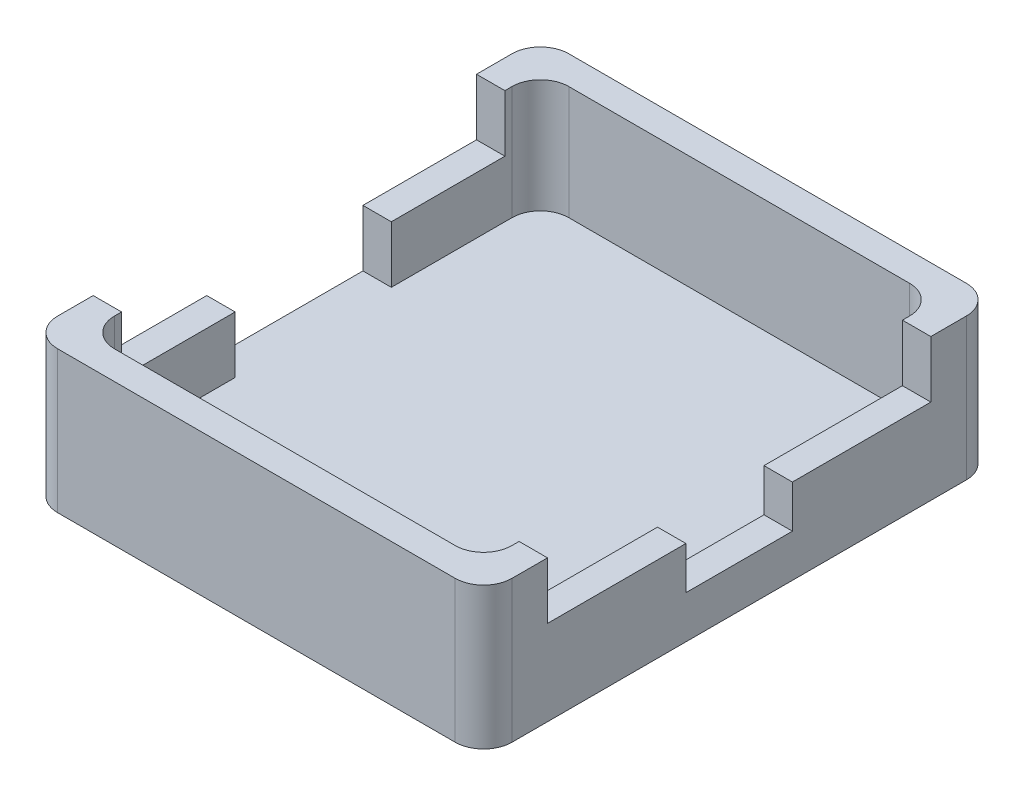
from build123d import *

# Parameters (mm, degrees)
SKETCH1_W           = 32
SKETCH1_H           = 36
BOSS_EXTRUDE1_DEPTH = 2
SKETCH2_W           = 32
SKETCH2_H           = 36
SKETCH2_W_2         = 28
SKETCH2_H_2         = 32
BOSS_EXTRUDE2_DEPTH = 8
CUT_EXTRUDE1_DEPTH  = 2
CUT_EXTRUDE2_DEPTH  = 2
FILLET1_R           = 2


with BuildPart() as part:
    # Sketch1 → Boss-Extrude1 (new body)
    with BuildSketch(Plane(origin=(0, 0, 0), x_dir=(1, 0, 0), z_dir=(0, 1, 0))):
        Rectangle(SKETCH1_W, SKETCH1_H)
    extrude(amount=BOSS_EXTRUDE1_DEPTH)

    # Sketch2 → Boss-Extrude2 (add)
    with BuildSketch(Plane(origin=(0, 2, 0), x_dir=(1, 0, 0), z_dir=(0, 1, 0))):
        Rectangle(SKETCH2_W, SKETCH2_H)
        Rectangle(SKETCH2_W_2, SKETCH2_H_2, mode=Mode.SUBTRACT)
    extrude(amount=BOSS_EXTRUDE2_DEPTH)

    # Sketch3 → Cut-Extrude1 (cut)
    with BuildSketch(Plane.ZY.offset(16)):
        Polygon((-13.5, 10), (-13.5, 6), (-5.5, 6), (-5.5, 2), (5.5, 2), (5.5, 6), (13.5, 6), (13.5, 10), align=None)
    extrude(amount=-CUT_EXTRUDE1_DEPTH, mode=Mode.SUBTRACT)

    # Sketch4 → Cut-Extrude2 (cut)
    with BuildSketch(Plane(origin=(16, 0, 0), x_dir=(0, 0, -1), z_dir=(1, 0, 0))):
        Polygon((-13.5, 10), (-13.5, 6), (-3.75, 6), (-3.75, 3), (3.75, 3), (3.75, 6), (13.5, 6), (13.5, 10), align=None)
    extrude(amount=-CUT_EXTRUDE2_DEPTH, mode=Mode.SUBTRACT)

    # Fillet1
    fillet1_edges = [part.edges().sort_by_distance(p)[0] for p in [
        (14, 6, -16),
        (14, 6, 16),
        (-14, 6, 16),
        (-14, 6, -16),
        (16, 5, 18),
        (-16, 5, 18),
        (-16, 5, -18),
        (16, 5, -18),
    ]]
    fillet(fillet1_edges, radius=FILLET1_R)


solid = part.part
